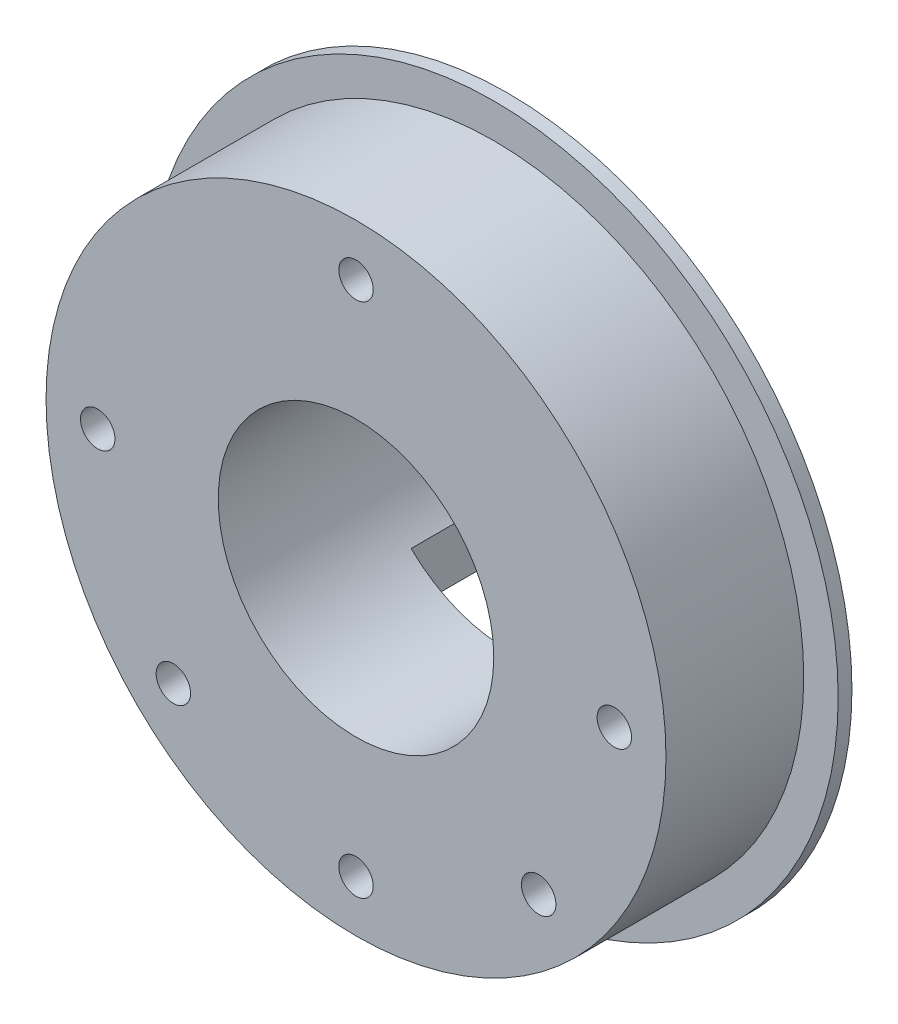
from build123d import *

# Parameters (mm, degrees)
SKETCH_1_R               = 13
EXTRUDE_1_DEPTH          = 2
SKETCH_2_R               = 13
SKETCH_2_R_2             = 10
EXTRUDE_2_DEPTH          = 5
SKETCH_4_R               = 25
SKETCH_4_R_2             = 10
EXTRUDE_3_DEPTH          = 1
SKETCH_5_R               = 22.5
SKETCH_5_R_2             = 10
EXTRUDE_4_DEPTH          = 10
SKETCH_6_R               = 1.25
CUT_EXTRUDE_1_DEPTH      = 8
SKETCH_7_R               = 3
SKETCH_7_R_2             = 1
CUT_EXTRUDE_2_DEPTH      = 40.67366885
CUT_EXTRUDE_3_DEPTH      = 40.67366885
CUT_EXTRUDE_3_DEPTH_BACK = 40.67366885
SKETCH_8_W               = 14
SKETCH_8_H               = 5


with BuildPart() as part:
    # 스케치1 → 보스-돌출1 (new body)
    with BuildSketch(Plane.XY):
        Circle(SKETCH_1_R)
    extrude(amount=EXTRUDE_1_DEPTH)

    # 스케치2 → 보스-돌출2 (add)
    with BuildSketch(Plane.XY.offset(2)):
        Circle(SKETCH_2_R)
        Circle(SKETCH_2_R_2, mode=Mode.SUBTRACT)
    extrude(amount=EXTRUDE_2_DEPTH)

    # 스케치4 → 보스-돌출3 (add)
    with BuildSketch(Plane.XY.offset(7)):
        Circle(SKETCH_4_R)
        Circle(SKETCH_4_R_2, mode=Mode.SUBTRACT)
    extrude(amount=EXTRUDE_3_DEPTH)

    # 스케치5 → 보스-돌출4 (add)
    with BuildSketch(Plane.XY.offset(8)):
        Circle(SKETCH_5_R)
        Circle(SKETCH_5_R_2, mode=Mode.SUBTRACT)
    extrude(amount=EXTRUDE_4_DEPTH)

    # 스케치6 → 컷-돌출1 (cut)
    with BuildSketch(Plane.XY.offset(18)):
        with Locations((0, 18.75)):
            Circle(SKETCH_6_R)
        with Locations((18.75, 0)):
            Circle(SKETCH_6_R)
        with Locations((13.258252147, -13.258252147)):
            Circle(SKETCH_6_R)
        with Locations((0, -18.75)):
            Circle(SKETCH_6_R)
        with Locations((-13.258252147, -13.258252147)):
            Circle(SKETCH_6_R)
        with Locations((-18.75, 0)):
            Circle(SKETCH_6_R)
    extrude(amount=-CUT_EXTRUDE_1_DEPTH, mode=Mode.SUBTRACT)

    # 스케치7 → 컷-돌출2 (cut, through all)
    with BuildSketch(Plane(origin=(0, 0, 0), x_dir=(-1, 0, 0), z_dir=(0, 0, -1))):
        Circle(SKETCH_7_R)
        with Locations((0, 7)):
            Circle(SKETCH_7_R_2)
        with Locations((0, -7)):
            Circle(SKETCH_7_R_2)
        with Locations((-7, 3)):
            Circle(SKETCH_7_R_2)
        with Locations((-7, -3)):
            Circle(SKETCH_7_R_2)
        with Locations((7, 3)):
            Circle(SKETCH_7_R_2)
        with Locations((7, -3)):
            Circle(SKETCH_7_R_2)
    extrude(amount=-CUT_EXTRUDE_2_DEPTH, mode=Mode.SUBTRACT)

    # 스케치8 → 컷-돌출3 (cut, two sides: drawn at the far end of the back side and taken through both)
    with BuildSketch(Plane(origin=(0, 0, 0), x_dir=(1, 0, 0), z_dir=(0, 1, 0)).offset(-CUT_EXTRUDE_3_DEPTH_BACK)):
        with Locations((0, -4.5)):
            Rectangle(SKETCH_8_W, SKETCH_8_H)
    extrude(amount=CUT_EXTRUDE_3_DEPTH + CUT_EXTRUDE_3_DEPTH_BACK, mode=Mode.SUBTRACT)


solid = part.part
